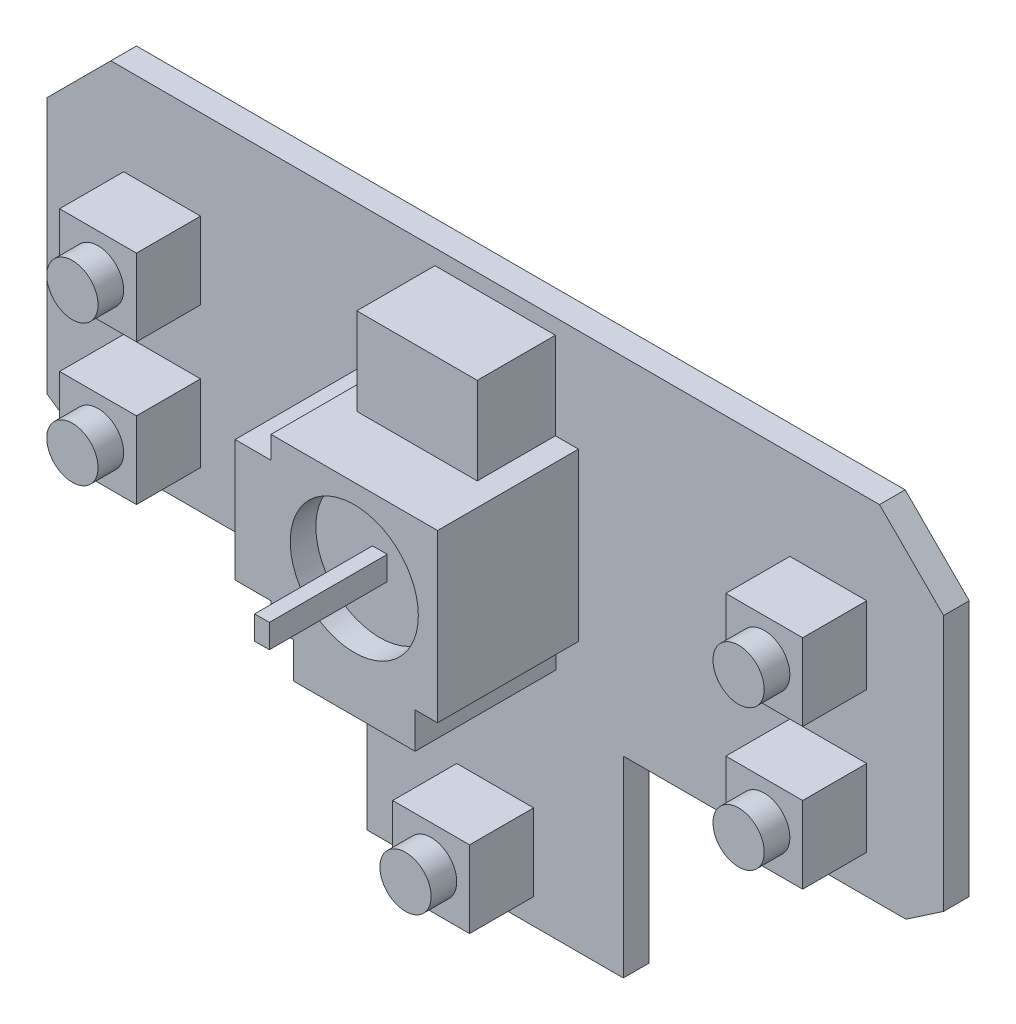
from build123d import *

# Parameters (mm, degrees)
EXTRUSION1_DEPTH             = 2
ESQUISSE2_W                  = 13
ESQUISSE2_H                  = 13
EXTRUSION2_DEPTH             = 11
ESQUISSE7_W                  = 9.4
ESQUISSE7_H                  = 6.8
EXTRUSION7_DEPTH             = 6.1
ESQUISSE8_W                  = 2.8
ESQUISSE8_H                  = 9.5
ESQUISSE8_W_2                = 9.5
ESQUISSE8_H_2                = 2.8
EXTRUSION8_DEPTH             = 11
ESQUISSE6_R                  = 5
EXTRUSION6_DEPTH             = 2
ESQUISSE3_W                  = 6
ESQUISSE3_H                  = 6
EXTRUSION3_DEPTH             = 5
ESQUISSE5_R                  = 2
EXTRUSION5_DEPTH             = 2
ESQUISSE9_W                  = 1.15
ESQUISSE9_H                  = 1.85
EXTRUSION9_DEPTH             = 7.2
EXTRUSION9_DIRECTION_2_REACH = 84.662


with BuildPart() as part:
    # Esquisse1 → Extrusion1 (new body)
    with BuildSketch(Plane.XY):
        Polygon((2.941176471, -27), (25, -27), (25, -42), (45, -42), (45, -27), (67.058823529, -27), (70, -25), (70, -5), (65, 0), (5, 0), (0, -5), (0, -25), align=None)
    extrude(amount=-EXTRUSION1_DEPTH)

    # Esquisse2 → Extrusion2 (add)
    with BuildSketch(Plane.XY):
        with Locations((35, -14.5)):
            Rectangle(ESQUISSE2_W, ESQUISSE2_H)
    extrude(amount=EXTRUSION2_DEPTH)

    # Esquisse7 → Extrusion7 (add)
    with BuildSketch(Plane.XY):
        with Locations((35, -4.6)):
            Rectangle(ESQUISSE7_W, ESQUISSE7_H)
    extrude(amount=EXTRUSION7_DEPTH)

    # Esquisse8 → Extrusion8 (add)
    with BuildSketch(Plane.XY):
        with Locations((27.1, -14.5)):
            Rectangle(ESQUISSE8_W, ESQUISSE8_H)
        with Locations((35, -22.4)):
            Rectangle(ESQUISSE8_W_2, ESQUISSE8_H_2)
    extrude(amount=EXTRUSION8_DEPTH)

    # Esquisse6 → Extrusion6 (cut)
    with BuildSketch(Plane.XY.offset(11)):
        with Locations((35, -14.5)):
            Circle(ESQUISSE6_R)
    extrude(amount=-EXTRUSION6_DEPTH, mode=Mode.SUBTRACT)

    # Esquisse3 → Extrusion3 (add)
    with BuildSketch(Plane.XY):
        with Locations((9, -21)):
            Rectangle(ESQUISSE3_W, ESQUISSE3_H)
        with Locations((9, -10)):
            Rectangle(ESQUISSE3_W, ESQUISSE3_H)
        with Locations((35, -37)):
            Rectangle(ESQUISSE3_W, ESQUISSE3_H)
        with Locations((61, -10)):
            Rectangle(ESQUISSE3_W, ESQUISSE3_H)
        with Locations((61, -21)):
            Rectangle(ESQUISSE3_W, ESQUISSE3_H)
    extrude(amount=EXTRUSION3_DEPTH)

    # Esquisse5 → Extrusion5 (add)
    with BuildSketch(Plane.XY.offset(5)):
        with Locations((9, -10)):
            Circle(ESQUISSE5_R)
        with Locations((9, -21)):
            Circle(ESQUISSE5_R)
        with Locations((61, -21)):
            Circle(ESQUISSE5_R)
        with Locations((61, -10)):
            Circle(ESQUISSE5_R)
        with Locations((35, -37)):
            Circle(ESQUISSE5_R)
    extrude(amount=EXTRUSION5_DEPTH)

    # Esquisse9 → Extrusion9 (add)
    with BuildSketch(Plane.XY.offset(11)):
        with Locations((35, -14.5)):
            Rectangle(ESQUISSE9_W, ESQUISSE9_H)
    extrude(amount=EXTRUSION9_DEPTH)

    # Esquisse9 → Extrusion9 direction 2 (add, up to next)
    with BuildSketch(Plane.XY.offset(11), mode=Mode.PRIVATE) as extrusion9_direction_2_sk1:
        with Locations((35, -14.5)):
            Rectangle(ESQUISSE9_W, ESQUISSE9_H)
    extrusion9_direction_2_tool1 = extrude(extrusion9_direction_2_sk1.sketch, amount=-EXTRUSION9_DIRECTION_2_REACH, mode=Mode.PRIVATE) - part.part
    add(extrusion9_direction_2_tool1.solids().sort_by_distance((35, -14.5, 11))[0])


solid = part.part
